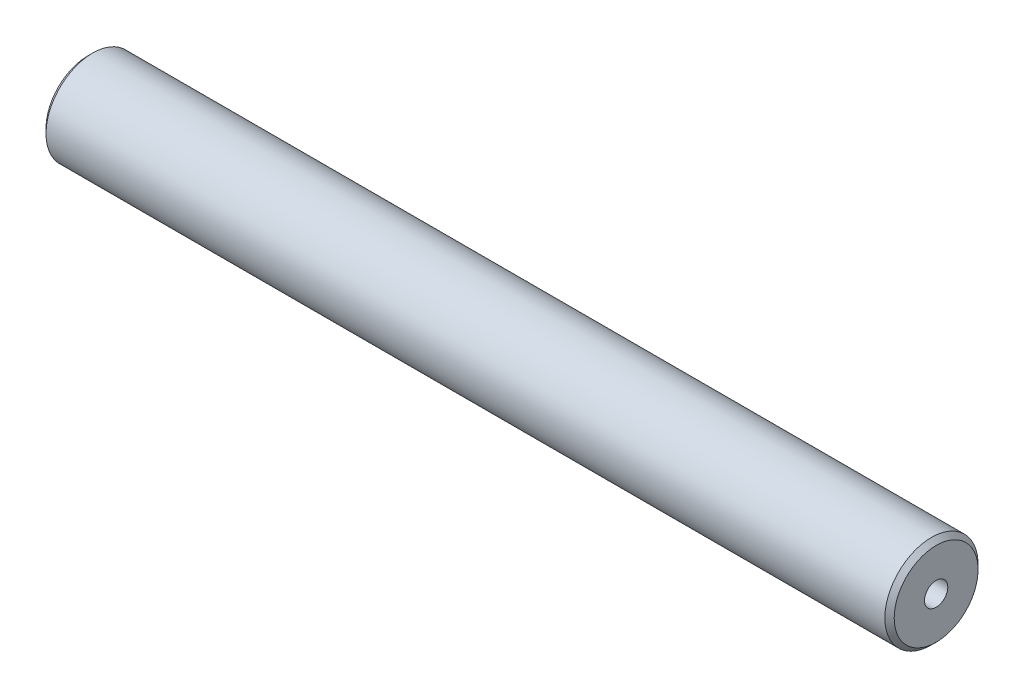
from build123d import *

# Parameters (mm, degrees)
ESBO_O1_W                 = 182
ESBO_O1_H                 = 10
CHANFRO1_SIZE             = 1
FURO_ROSCADO_DE_M61_D     = 5
FURO_ROSCADO_DE_M61_DEPTH = 17
FURO_ROSCADO_DE_M61_TIP   = 1.502151548
FURO_ROSCADO_DE_M62_D     = 5
FURO_ROSCADO_DE_M62_DEPTH = 17
FURO_ROSCADO_DE_M62_TIP   = 1.502151548


with BuildPart() as part:
    # Esboço1 → Revolução1 (revolve)
    with BuildSketch(Plane.XY, mode=Mode.PRIVATE) as revolu_o1_sk:
        with Locations((91, 5)):
            Rectangle(ESBO_O1_W, ESBO_O1_H)
    revolve(revolu_o1_sk.sketch.rotate(Axis((0, 0, 0), (1, 0, 0)), 90), axis=Axis((0, 0, 0), (1, 0, 0)))

    # Chanfro1
    chanfro1_edges = [part.edges().sort_by_distance(p)[0] for p in [
        (182, 0, -10),
        (0, 0, -10),
    ]]
    chamfer(chanfro1_edges, length=CHANFRO1_SIZE)

    # Furo roscado de M61
    with Locations(Plane(origin=(182, 0, 0), x_dir=(0, 0, -1), z_dir=(1, 0, 0))):
        with Locations((0, 0)):
            Hole(FURO_ROSCADO_DE_M61_D / 2, depth=FURO_ROSCADO_DE_M61_DEPTH)
            with Locations((0, 0, -(FURO_ROSCADO_DE_M61_DEPTH + FURO_ROSCADO_DE_M61_TIP / 2))):  # 118° drill point
                Cone(0, FURO_ROSCADO_DE_M61_D / 2, FURO_ROSCADO_DE_M61_TIP, mode=Mode.SUBTRACT)

    # Furo roscado de M62
    with Locations(Plane.ZY):
        with Locations((0, 0)):
            Hole(FURO_ROSCADO_DE_M62_D / 2, depth=FURO_ROSCADO_DE_M62_DEPTH)
            with Locations((0, 0, -(FURO_ROSCADO_DE_M62_DEPTH + FURO_ROSCADO_DE_M62_TIP / 2))):  # 118° drill point
                Cone(0, FURO_ROSCADO_DE_M62_D / 2, FURO_ROSCADO_DE_M62_TIP, mode=Mode.SUBTRACT)


solid = part.part
